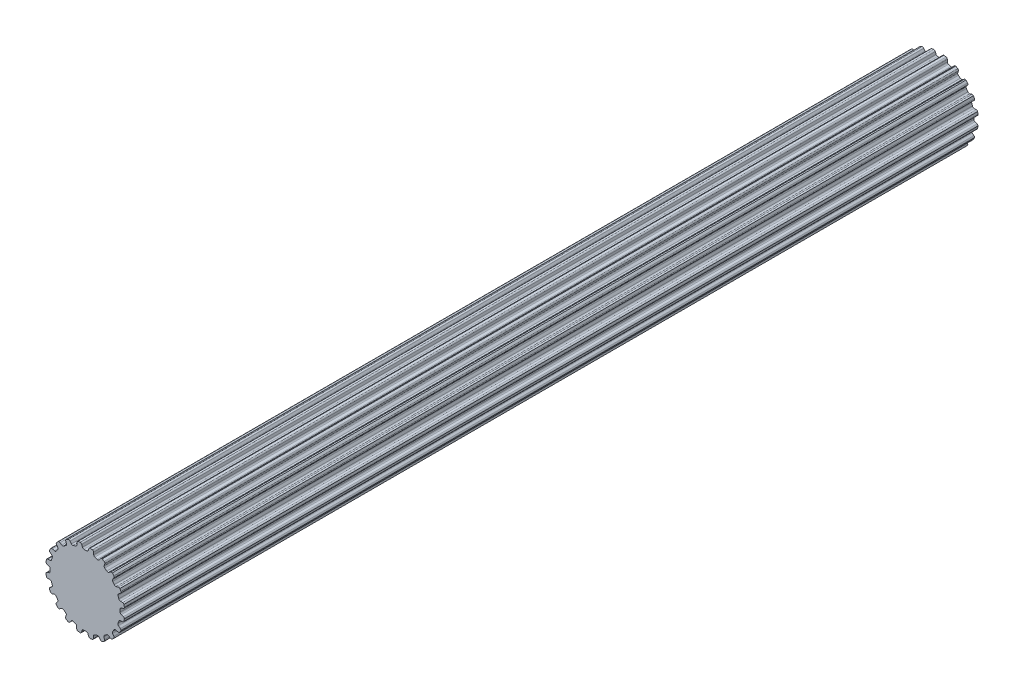
from build123d import *

# Parameters (mm, degrees)
BOSS_EXTRUDE1_DEPTH = 36.23056


with BuildPart() as part:
    # Sketch1 → Boss-Extrude1 (new, symmetric)
    with BuildSketch(Plane.XY):
        with BuildLine():
            Line((-0.106949245, 2.969874934), (0.106949245, 2.969874934))
            ThreePointArc((0.106949245, 2.969874934), (0.196343213, 2.986924176), (0.253739238, 3.057547504))
            Line((0.253739238, 3.057547504), (0.315888147, 3.237526941))
            ThreePointArc((0.315888147, 3.237526941), (0.359032156, 3.298322911), (0.4281449, 3.326269005))
            Line((0.4281449, 3.326269005), (0.620027588, 3.2937547))
            ThreePointArc((0.620027588, 3.2937547), (0.689621142, 3.24802576), (0.718272212, 3.169836791))
            Line((0.718272212, 3.169836791), (0.724389167, 2.979527391))
            ThreePointArc((0.724389167, 2.979527391), (0.750934762, 2.9040661), (0.816027049, 2.857568043))
            Line((0.816027049, 2.857568043), (1.019456602, 2.791469774))
            ThreePointArc((1.019456602, 2.791469774), (1.109743823, 2.780060312), (1.186154496, 2.829490741))
            Line((1.186154496, 2.829490741), (1.300878326, 2.981456288))
            ThreePointArc((1.300878326, 2.981456288), (1.360697704, 3.02594446), (1.435063648, 3.031165762))
            Line((1.435063648, 3.031165762), (1.607507455, 2.940947809))
            ThreePointArc((1.607507455, 2.940947809), (1.659563839, 2.875951412), (1.662650905, 2.792735615))
            Line((1.662650905, 2.792735615), (1.609659636, 2.609850378))
            ThreePointArc((1.609659636, 2.609850378), (1.611587176, 2.529879385), (1.659124931, 2.465542482))
            Line((1.659124931, 2.465542482), (1.832172444, 2.339816104))
            ThreePointArc((1.832172444, 2.339816104), (1.914514976, 2.301064775), (2.002460687, 2.32446371))
            Line((2.002460687, 2.32446371), (2.158529469, 2.433539921))
            ThreePointArc((2.158529469, 2.433539921), (2.229168681, 2.457365482), (2.301508367, 2.439350895))
            Line((2.301508367, 2.439350895), (2.437633293, 2.300260456))
            ThreePointArc((2.437633293, 2.300260456), (2.467056864, 2.222358901), (2.444277744, 2.14226202))
            Line((2.444277744, 2.14226202), (2.337365406, 1.984703026))
            ThreePointArc((2.337365406, 1.984703026), (2.314486209, 1.908050449), (2.339816104, 1.832172444))
            Line((2.339816104, 1.832172444), (2.465542482, 1.659124931))
            ThreePointArc((2.465542482, 1.659124931), (2.531880064, 1.596824985), (2.622752074, 1.591901975))
            Line((2.622752074, 1.591901975), (2.804888709, 1.64741171))
            ThreePointArc((2.804888709, 1.64741171), (2.879433095, 1.648242449), (2.942665411, 1.608755366))
            Line((2.942665411, 1.608755366), (3.0291466, 1.434407582))
            ThreePointArc((3.0291466, 1.434407582), (3.033057175, 1.351226417), (2.986641646, 1.282088892))
            Line((2.986641646, 1.282088892), (2.836273564, 1.165279113))
            ThreePointArc((2.836273564, 1.165279113), (2.790827206, 1.099448241), (2.791469774, 1.019456602))
            Line((2.791469774, 1.019456602), (2.857568043, 0.816027049))
            ThreePointArc((2.857568043, 0.816027049), (2.901407091, 0.736276839), (2.986310214, 0.703513784))
            Line((2.986310214, 0.703513784), (3.1766859, 0.700023363))
            ThreePointArc((3.1766859, 0.700023363), (3.247838536, 0.677777961), (3.295773863, 0.620683653))
            Line((3.295773863, 0.620683653), (3.324145932, 0.4281449))
            ThreePointArc((3.324145932, 0.4281449), (3.302160717, 0.347826477), (3.236652255, 0.29641597))
            Line((3.236652255, 0.29641597), (3.057547504, 0.231789562))
            ThreePointArc((3.057547504, 0.231789562), (2.993982591, 0.183224379), (2.969874934, 0.106949245))
            Line((2.969874934, 0.106949245), (2.969874934, -0.106949245))
            ThreePointArc((2.969874934, -0.106949245), (2.986924176, -0.196343213), (3.057547504, -0.253739238))
            Line((3.057547504, -0.253739238), (3.237526941, -0.315888147))
            ThreePointArc((3.237526941, -0.315888147), (3.298322911, -0.359032156), (3.326269005, -0.4281449))
            Line((3.326269005, -0.4281449), (3.2937547, -0.620027588))
            ThreePointArc((3.2937547, -0.620027588), (3.24802576, -0.689621142), (3.169836791, -0.718272212))
            Line((3.169836791, -0.718272212), (2.979527391, -0.724389167))
            ThreePointArc((2.979527391, -0.724389167), (2.9040661, -0.750934762), (2.857568043, -0.816027049))
            Line((2.857568043, -0.816027049), (2.791469774, -1.019456602))
            ThreePointArc((2.791469774, -1.019456602), (2.780060312, -1.109743823), (2.829490741, -1.186154496))
            Line((2.829490741, -1.186154496), (2.981456288, -1.300878326))
            ThreePointArc((2.981456288, -1.300878326), (3.02594446, -1.360697704), (3.031165762, -1.435063648))
            Line((3.031165762, -1.435063648), (2.940947809, -1.607507455))
            ThreePointArc((2.940947809, -1.607507455), (2.875951412, -1.659563839), (2.792735615, -1.662650905))
            Line((2.792735615, -1.662650905), (2.609850378, -1.609659636))
            ThreePointArc((2.609850378, -1.609659636), (2.529879385, -1.611587176), (2.465542482, -1.659124931))
            Line((2.465542482, -1.659124931), (2.339816104, -1.832172444))
            ThreePointArc((2.339816104, -1.832172444), (2.301064775, -1.914514976), (2.32446371, -2.002460687))
            Line((2.32446371, -2.002460687), (2.433539921, -2.158529469))
            ThreePointArc((2.433539921, -2.158529469), (2.457365482, -2.229168681), (2.439350895, -2.301508367))
            Line((2.439350895, -2.301508367), (2.300260456, -2.437633293))
            ThreePointArc((2.300260456, -2.437633293), (2.222358901, -2.467056864), (2.14226202, -2.444277744))
            Line((2.14226202, -2.444277744), (1.984703026, -2.337365406))
            ThreePointArc((1.984703026, -2.337365406), (1.908050449, -2.314486209), (1.832172444, -2.339816104))
            Line((1.832172444, -2.339816104), (1.659124931, -2.465542482))
            ThreePointArc((1.659124931, -2.465542482), (1.596824985, -2.531880064), (1.591901975, -2.622752074))
            Line((1.591901975, -2.622752074), (1.64741171, -2.804888709))
            ThreePointArc((1.64741171, -2.804888709), (1.648242449, -2.879433095), (1.608755366, -2.942665411))
            Line((1.608755366, -2.942665411), (1.434407582, -3.0291466))
            ThreePointArc((1.434407582, -3.0291466), (1.351226417, -3.033057175), (1.282088892, -2.986641646))
            Line((1.282088892, -2.986641646), (1.165279113, -2.836273564))
            ThreePointArc((1.165279113, -2.836273564), (1.099448241, -2.790827206), (1.019456602, -2.791469774))
            Line((1.019456602, -2.791469774), (0.816027049, -2.857568043))
            ThreePointArc((0.816027049, -2.857568043), (0.736276839, -2.901407091), (0.703513784, -2.986310214))
            Line((0.703513784, -2.986310214), (0.700023363, -3.1766859))
            ThreePointArc((0.700023363, -3.1766859), (0.677777961, -3.247838536), (0.620683653, -3.295773863))
            Line((0.620683653, -3.295773863), (0.4281449, -3.324145932))
            ThreePointArc((0.4281449, -3.324145932), (0.347826477, -3.302160717), (0.29641597, -3.236652255))
            Line((0.29641597, -3.236652255), (0.231789562, -3.057547504))
            ThreePointArc((0.231789562, -3.057547504), (0.183224379, -2.993982591), (0.106949245, -2.969874934))
            Line((0.106949245, -2.969874934), (-0.106949245, -2.969874934))
            ThreePointArc((-0.106949245, -2.969874934), (-0.196343213, -2.986924176), (-0.253739238, -3.057547504))
            Line((-0.253739238, -3.057547504), (-0.315888147, -3.237526941))
            ThreePointArc((-0.315888147, -3.237526941), (-0.359032156, -3.298322911), (-0.4281449, -3.326269005))
            Line((-0.4281449, -3.326269005), (-0.620027588, -3.2937547))
            ThreePointArc((-0.620027588, -3.2937547), (-0.689621142, -3.24802576), (-0.718272212, -3.169836791))
            Line((-0.718272212, -3.169836791), (-0.724389167, -2.979527391))
            ThreePointArc((-0.724389167, -2.979527391), (-0.750934762, -2.9040661), (-0.816027049, -2.857568043))
            Line((-0.816027049, -2.857568043), (-1.019456602, -2.791469774))
            ThreePointArc((-1.019456602, -2.791469774), (-1.109743823, -2.780060312), (-1.186154496, -2.829490741))
            Line((-1.186154496, -2.829490741), (-1.300878326, -2.981456288))
            ThreePointArc((-1.300878326, -2.981456288), (-1.360697704, -3.02594446), (-1.435063648, -3.031165762))
            Line((-1.435063648, -3.031165762), (-1.607507455, -2.940947809))
            ThreePointArc((-1.607507455, -2.940947809), (-1.659563839, -2.875951412), (-1.662650905, -2.792735615))
            Line((-1.662650905, -2.792735615), (-1.609659636, -2.609850378))
            ThreePointArc((-1.609659636, -2.609850378), (-1.611587176, -2.529879385), (-1.659124931, -2.465542482))
            Line((-1.659124931, -2.465542482), (-1.832172444, -2.339816104))
            ThreePointArc((-1.832172444, -2.339816104), (-1.914514976, -2.301064775), (-2.002460687, -2.32446371))
            Line((-2.002460687, -2.32446371), (-2.158529469, -2.433539921))
            ThreePointArc((-2.158529469, -2.433539921), (-2.229168681, -2.457365482), (-2.301508367, -2.439350895))
            Line((-2.301508367, -2.439350895), (-2.437633293, -2.300260456))
            ThreePointArc((-2.437633293, -2.300260456), (-2.467056864, -2.222358901), (-2.444277744, -2.14226202))
            Line((-2.444277744, -2.14226202), (-2.337365406, -1.984703026))
            ThreePointArc((-2.337365406, -1.984703026), (-2.314486209, -1.908050449), (-2.339816104, -1.832172444))
            Line((-2.339816104, -1.832172444), (-2.465542482, -1.659124931))
            ThreePointArc((-2.465542482, -1.659124931), (-2.531880064, -1.596824985), (-2.622752074, -1.591901975))
            Line((-2.622752074, -1.591901975), (-2.804888709, -1.64741171))
            ThreePointArc((-2.804888709, -1.64741171), (-2.879433095, -1.648242449), (-2.942665411, -1.608755366))
            Line((-2.942665411, -1.608755366), (-3.0291466, -1.434407582))
            ThreePointArc((-3.0291466, -1.434407582), (-3.033057175, -1.351226417), (-2.986641646, -1.282088892))
            Line((-2.986641646, -1.282088892), (-2.836273564, -1.165279113))
            ThreePointArc((-2.836273564, -1.165279113), (-2.790827206, -1.099448241), (-2.791469774, -1.019456602))
            Line((-2.791469774, -1.019456602), (-2.857568043, -0.816027049))
            ThreePointArc((-2.857568043, -0.816027049), (-2.901407091, -0.736276839), (-2.986310214, -0.703513784))
            Line((-2.986310214, -0.703513784), (-3.1766859, -0.700023363))
            ThreePointArc((-3.1766859, -0.700023363), (-3.247838536, -0.677777961), (-3.295773863, -0.620683653))
            Line((-3.295773863, -0.620683653), (-3.324145932, -0.4281449))
            ThreePointArc((-3.324145932, -0.4281449), (-3.302160717, -0.347826477), (-3.236652255, -0.29641597))
            Line((-3.236652255, -0.29641597), (-3.057547504, -0.231789562))
            ThreePointArc((-3.057547504, -0.231789562), (-2.993982591, -0.183224379), (-2.969874934, -0.106949245))
            Line((-2.969874934, -0.106949245), (-2.969874934, 0.106949245))
            ThreePointArc((-2.969874934, 0.106949245), (-2.986924176, 0.196343213), (-3.057547504, 0.253739238))
            Line((-3.057547504, 0.253739238), (-3.237526941, 0.315888147))
            ThreePointArc((-3.237526941, 0.315888147), (-3.298322911, 0.359032156), (-3.326269005, 0.4281449))
            Line((-3.326269005, 0.4281449), (-3.2937547, 0.620027588))
            ThreePointArc((-3.2937547, 0.620027588), (-3.24802576, 0.689621142), (-3.169836791, 0.718272212))
            Line((-3.169836791, 0.718272212), (-2.979527391, 0.724389167))
            ThreePointArc((-2.979527391, 0.724389167), (-2.9040661, 0.750934762), (-2.857568043, 0.816027049))
            Line((-2.857568043, 0.816027049), (-2.791469774, 1.019456602))
            ThreePointArc((-2.791469774, 1.019456602), (-2.780060312, 1.109743823), (-2.829490741, 1.186154496))
            Line((-2.829490741, 1.186154496), (-2.981456288, 1.300878326))
            ThreePointArc((-2.981456288, 1.300878326), (-3.02594446, 1.360697704), (-3.031165762, 1.435063648))
            Line((-3.031165762, 1.435063648), (-2.940947809, 1.607507455))
            ThreePointArc((-2.940947809, 1.607507455), (-2.875951412, 1.659563839), (-2.792735615, 1.662650905))
            Line((-2.792735615, 1.662650905), (-2.609850378, 1.609659636))
            ThreePointArc((-2.609850378, 1.609659636), (-2.529879385, 1.611587176), (-2.465542482, 1.659124931))
            Line((-2.465542482, 1.659124931), (-2.339816104, 1.832172444))
            ThreePointArc((-2.339816104, 1.832172444), (-2.301064775, 1.914514976), (-2.32446371, 2.002460687))
            Line((-2.32446371, 2.002460687), (-2.433539921, 2.158529469))
            ThreePointArc((-2.433539921, 2.158529469), (-2.457365482, 2.229168681), (-2.439350895, 2.301508367))
            Line((-2.439350895, 2.301508367), (-2.300260456, 2.437633293))
            ThreePointArc((-2.300260456, 2.437633293), (-2.222358901, 2.467056864), (-2.14226202, 2.444277744))
            Line((-2.14226202, 2.444277744), (-1.984703026, 2.337365406))
            ThreePointArc((-1.984703026, 2.337365406), (-1.908050449, 2.314486209), (-1.832172444, 2.339816104))
            Line((-1.832172444, 2.339816104), (-1.659124931, 2.465542482))
            ThreePointArc((-1.659124931, 2.465542482), (-1.596824985, 2.531880064), (-1.591901975, 2.622752074))
            Line((-1.591901975, 2.622752074), (-1.64741171, 2.804888709))
            ThreePointArc((-1.64741171, 2.804888709), (-1.648242449, 2.879433095), (-1.608755366, 2.942665411))
            Line((-1.608755366, 2.942665411), (-1.434407582, 3.0291466))
            ThreePointArc((-1.434407582, 3.0291466), (-1.351226417, 3.033057175), (-1.282088892, 2.986641646))
            Line((-1.282088892, 2.986641646), (-1.165279113, 2.836273564))
            ThreePointArc((-1.165279113, 2.836273564), (-1.099448241, 2.790827206), (-1.019456602, 2.791469774))
            Line((-1.019456602, 2.791469774), (-0.816027049, 2.857568043))
            ThreePointArc((-0.816027049, 2.857568043), (-0.736276839, 2.901407091), (-0.703513784, 2.986310214))
            Line((-0.703513784, 2.986310214), (-0.700023363, 3.1766859))
            ThreePointArc((-0.700023363, 3.1766859), (-0.677777961, 3.247838536), (-0.620683653, 3.295773863))
            Line((-0.620683653, 3.295773863), (-0.4281449, 3.324145932))
            ThreePointArc((-0.4281449, 3.324145932), (-0.347826477, 3.302160717), (-0.29641597, 3.236652255))
            Line((-0.29641597, 3.236652255), (-0.231789562, 3.057547504))
            ThreePointArc((-0.231789562, 3.057547504), (-0.183224379, 2.993982591), (-0.106949245, 2.969874934))
        make_face()
    extrude(amount=BOSS_EXTRUDE1_DEPTH, both=True)


solid = part.part
